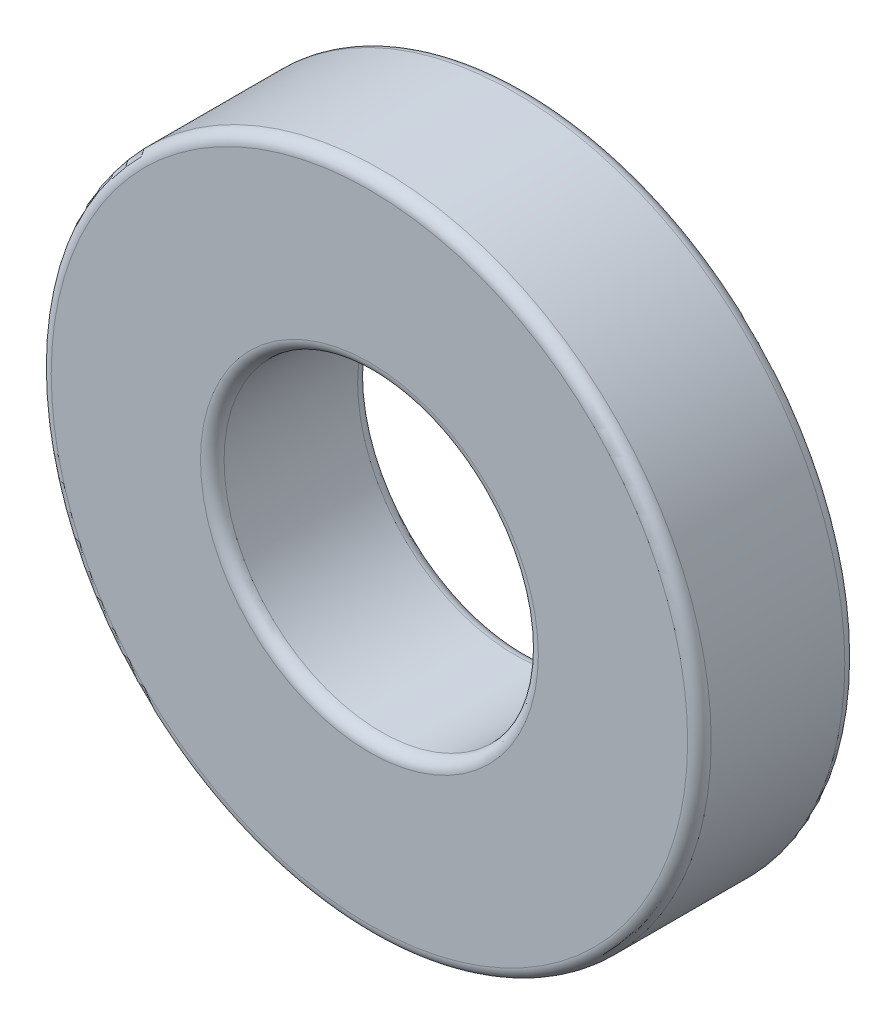
from build123d import *

# Parameters (mm, degrees)
ESQUISSE1_R        = 21
ESQUISSE1_R_2      = 10
BOSS_EXTRU_1_DEPTH = 10
CONG_1_R           = 0.75


with BuildPart() as part:
    # Esquisse1 → Boss.-Extru.1 (new body)
    with BuildSketch(Plane.XY):
        Circle(ESQUISSE1_R)
        Circle(ESQUISSE1_R_2, mode=Mode.SUBTRACT)
    extrude(amount=BOSS_EXTRU_1_DEPTH)

    # Congé1
    cong_1_edges = [part.edges().sort_by_distance(p)[0] for p in [
        (-21, 0, 0),
        (-21, 0, 10),
        (-10, 0, 0),
        (-10, 0, 10),
    ]]
    fillet(cong_1_edges, radius=CONG_1_R)


solid = part.part
